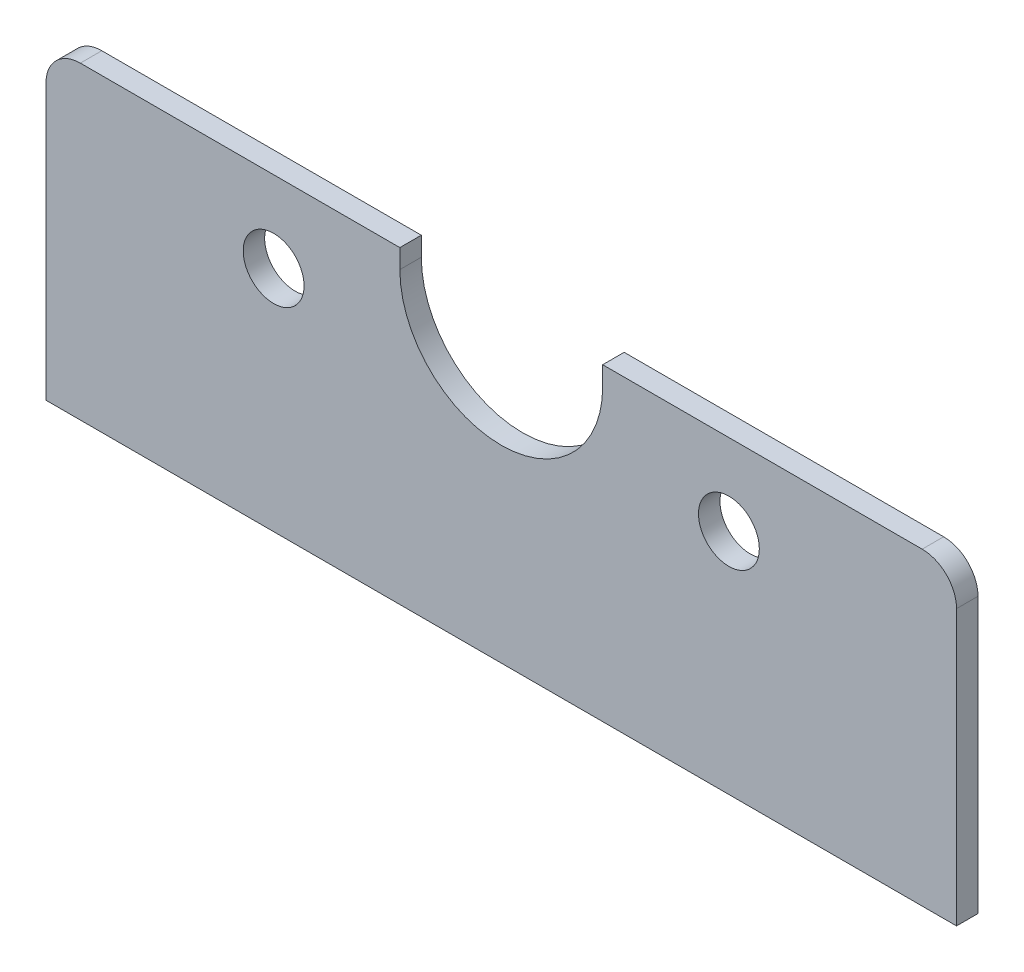
from build123d import *

# Parameters (mm, degrees)
BOSS_EXTRUDE1_DEPTH  = 1.5875
M4_CLEARANCE_HOLE1_D = 4.5
FILLET1_R            = 2.54


with BuildPart() as part:
    # Sketch1 → Boss-Extrude1 (new body)
    with BuildSketch(Plane.XY):
        with BuildLine():
            Line((4.9971849, 32.012776561), (-21.1688151, 32.012776561))
            Line((-21.1688151, 32.012776561), (-21.1688151, 9.152776561))
            Line((-21.1688151, 9.152776561), (46.1631849, 9.152776561))
            Line((46.1631849, 9.152776561), (46.1631849, 32.012776561))
            Line((46.1631849, 32.012776561), (19.9971849, 32.012776561))
            Line((19.9971849, 32.012776561), (19.9971849, 30.603076561))
            ThreePointArc((19.9971849, 30.603076561), (12.4971849, 23.103076561), (4.9971849, 30.603076561))
            Line((4.9971849, 30.603076561), (4.9971849, 32.012776561))
        make_face()
    extrude(amount=BOSS_EXTRUDE1_DEPTH)

    # M4 Clearance Hole1 (through all)
    with Locations(Plane.XY.offset(1.5875)):
        with Locations((-4.3358151, 26.012776561), (29.3301849, 26.012776561)):
            Hole(M4_CLEARANCE_HOLE1_D / 2)

    # Fillet1
    fillet1_edges = [part.edges().sort_by_distance(p)[0] for p in [
        (46.1631849, 32.012776561, 0.79375),
        (-21.1688151, 32.012776561, 0.79375),
    ]]
    fillet(fillet1_edges, radius=FILLET1_R)


solid = part.part
